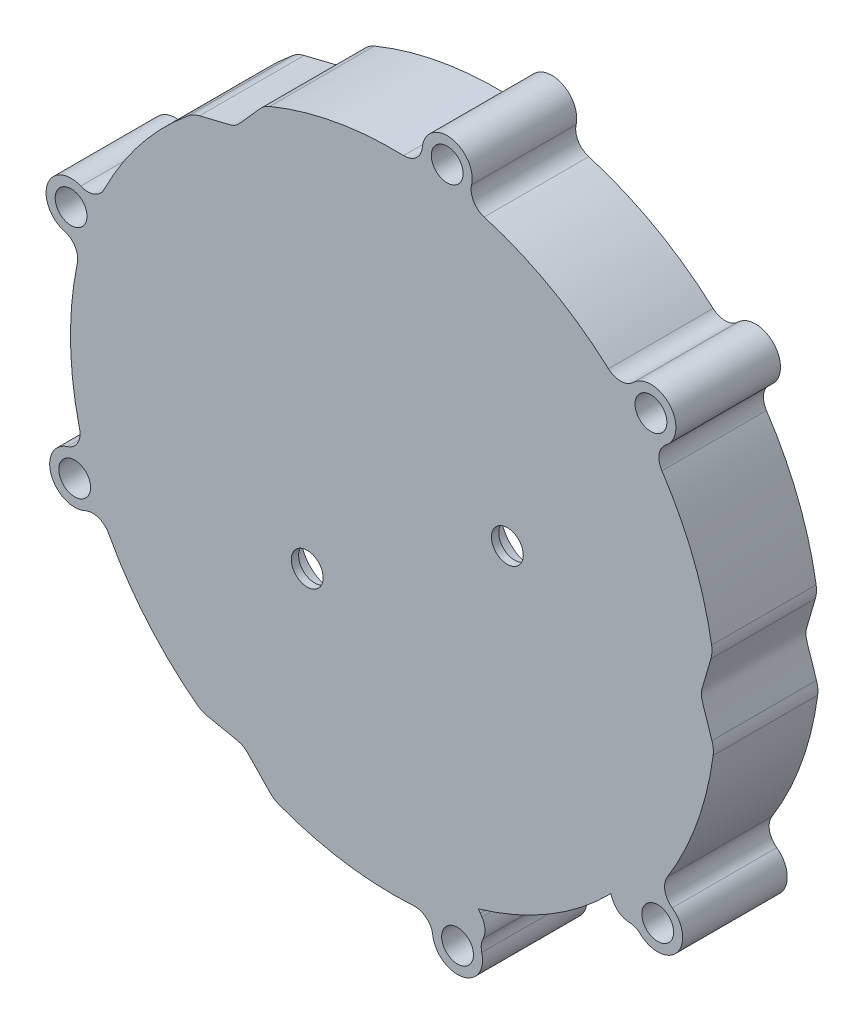
from build123d import *

# Parameters (mm, degrees)
EXTRUDE_2_DEPTH     = 11.5
SKETCH_5_R          = 33.5
EXTRUDE_3_DEPTH     = 3
CUT_EXTRUDE_START   = -11.5
SKETCH_6_R          = 1.75
SKETCH_6_R_2        = 1.55
CUT_EXTRUDE_1_DEPTH = 11.5
SKETCH_7_R          = 1.75
CUT_EXTRUDE_5_DEPTH = 132.924206488
SKETCH_10_R         = 3.75
CUT_EXTRUDE_6_DEPTH = 2.2


with BuildPart() as part:
    # 草图3 → 凸台-拉伸2 (new body)
    with BuildSketch(Plane.XY.offset(-96.014491648)):
        with BuildLine():
            Line((-40.492993239, 24.687278547), (-40.675739889, 24.962512607))
            ThreePointArc((-40.675739889, 24.962512607), (-41.606401052, 25.716071673), (-42.800739744, 25.802885006))
            ThreePointArc((-42.800739744, 25.802885006), (-80.374449004, 45.222565671), (-66.939487097, 85.327545701))
            ThreePointArc((-66.939487097, 85.327545701), (-25.249847673, 78.194412491), (-25.912786435, 35.904128301))
            ThreePointArc((-25.912786435, 35.904128301), (-26.40123425, 34.810784715), (-26.177519013, 33.634377915))
            Line((-26.177519013, 33.634377915), (-26.021463407, 33.343179059))
            ThreePointArc((-26.021463407, 33.343179059), (-25.312936916, 32.588336704), (-24.321913798, 32.288887294))
            ThreePointArc((-24.321913798, 32.288887294), (-23.626933575, 32.140579673), (-23.027680881, 31.758625659))
            ThreePointArc((-23.027680881, 31.758625659), (-21.445252865, 31.04285669), (-19.74949264, 31.418091156))
            ThreePointArc((-19.74949264, 31.418091156), (-18.413329107, 33.667805653), (-19.564814907, 36.017407482))
            ThreePointArc((-19.564814907, 36.017407482), (-20.364881109, 37.252986699), (-20.102685981, 38.701439544))
            ThreePointArc((-20.102685981, 38.701439544), (-16.832689757, 45.474182909), (-15.062839283, 52.783803781))
            ThreePointArc((-15.062839283, 52.783803781), (-15.051236485, 53.469213852), (-15.195529134, 54.139364))
            add(Edge.make_bspline(
                [(-15.319425238, 61.856583739), (-16.49572782, 57.978094374), (-15.195529134, 54.139364)],
                knots=[0, 0, 0, 1, 1, 1], degree=2, weights=[1, 8.246607766, 1]))
            ThreePointArc((-15.319425238, 61.856583739), (-15.196719258, 62.531020416), (-15.230318238, 63.215704794))
            ThreePointArc((-15.230318238, 63.215704794), (-17.226007888, 70.444721896), (-20.695764851, 77.093199319))
            ThreePointArc((-20.695764851, 77.093199319), (-20.808333579, 77.284774589), (-20.898956438, 77.487654603))
            ThreePointArc((-20.898956438, 77.487654603), (-20.953551538, 78.749586356), (-20.241057012, 79.792564747))
            ThreePointArc((-20.241057012, 79.792564747), (-19.26137688, 81.226660066), (-19.336445111, 82.961816342))
            ThreePointArc((-19.336445111, 82.961816342), (-21.319959034, 84.668339374), (-23.833818547, 83.942351293))
            ThreePointArc((-23.833818547, 83.942351293), (-25.189556573, 83.368995985), (-26.570474451, 83.878728977))
            ThreePointArc((-26.570474451, 83.878728977), (-32.983673797, 88.450483927), (-40.247058178, 91.495695992))
            ThreePointArc((-40.247058178, 91.495695992), (-40.456433036, 91.570093379), (-40.656262932, 91.667257235))
            ThreePointArc((-40.656262932, 91.667257235), (-41.509238891, 92.59885907), (-41.633850859, 93.855808482))
            ThreePointArc((-41.633850859, 93.855808482), (-41.805190186, 95.584116524), (-42.978033152, 96.865071337))
            ThreePointArc((-42.978033152, 96.865071337), (-45.594424834, 96.897365647), (-47.053496799, 94.725348761))
            ThreePointArc((-47.053496799, 94.725348761), (-47.723506694, 93.414681511), (-49.10900121, 92.917522737))
            ThreePointArc((-49.10900121, 92.917522737), (-56.60936713, 92.363050854), (-63.824609735, 90.24097589))
            ThreePointArc((-63.824609735, 90.24097589), (-64.423993666, 89.908319173), (-64.932214395, 89.448282999))
            add(Edge.make_bspline(
                [(-71.553574683, 85.482375956), (-67.606553074, 86.40291272), (-64.932214395, 89.448282999)],
                knots=[0, 0, 0, 1, 1, 1], degree=2, weights=[1, 8.246607766, 1]))
            ThreePointArc((-71.553574683, 85.482375956), (-72.199006969, 85.251424113), (-72.775161544, 84.879984354))
            ThreePointArc((-72.775161544, 84.879984354), (-78.037829174, 79.537157868), (-82.060701037, 73.208021481))
            ThreePointArc((-82.060701037, 73.208021481), (-82.170325724, 73.014746469), (-82.30071354, 72.834824764))
            ThreePointArc((-82.30071354, 72.834824764), (-83.366280763, 72.156578189), (-84.625773644, 72.252127162))
            ThreePointArc((-84.625773644, 72.252127162), (-86.357576852, 72.383507575), (-87.822732334, 71.450918397))
            ThreePointArc((-87.822732334, 71.450918397), (-88.308867667, 68.879883427), (-86.423213777, 67.065811271))
            ThreePointArc((-86.423213777, 67.065811271), (-85.248804513, 66.178385351), (-84.999787298, 64.727608899))
            ThreePointArc((-84.999787298, 64.727608899), (-85.752443552, 56.887737871), (-84.757982369, 49.074856447))
            ThreePointArc((-84.757982369, 49.074856447), (-84.717724968, 48.856333808), (-84.701956387, 48.634694114))
            ThreePointArc((-84.701956387, 48.634694114), (-85.082259885, 47.430193489), (-86.108505425, 46.693801882))
            ThreePointArc((-86.108505425, 46.693801882), (-87.51959303, 45.681263421), (-88.042510334, 44.02507507))
            ThreePointArc((-88.042510334, 44.02507507), (-86.762282187, 41.743066253), (-84.151724405, 41.565481306))
            ThreePointArc((-84.151724405, 41.565481306), (-82.681648322, 41.640569343), (-81.558348935, 40.689275282))
            ThreePointArc((-81.558348935, 40.689275282), (-77.327979239, 34.471003799), (-71.882587109, 29.283457891))
            ThreePointArc((-71.882587109, 29.283457891), (-71.294805975, 28.930704538), (-70.642292598, 28.720590563))
            add(Edge.make_bspline(
                [(-63.897036205, 24.969277868), (-66.667755232, 27.927230468), (-70.642292598, 28.720590563)],
                knots=[0, 0, 0, 1, 1, 1], degree=2, weights=[1, 8.246607766, 1]))
            ThreePointArc((-63.897036205, 24.969277868), (-63.374309899, 24.525793034), (-62.764556344, 24.212548414))
            ThreePointArc((-62.764556344, 24.212548414), (-55.506199065, 22.326357798), (-48.013570238, 22.007016761))
            ThreePointArc((-48.013570238, 22.007016761), (-47.791376824, 22.008716505), (-47.570366149, 21.985758196))
            ThreePointArc((-47.570366149, 21.985758196), (-46.450202396, 21.402071776), (-45.90320467, 20.263541953))
            ThreePointArc((-45.90320467, 20.263541953), (-45.151080965, 18.69806868), (-43.610858681, 17.895502823))
            ThreePointArc((-43.610858681, 17.895502823), (-41.14120942, 18.760014757), (-40.513003788, 21.300075001))
            ThreePointArc((-40.513003788, 21.300075001), (-40.566074024, 22.008719301), (-40.368008135, 22.691187687))
            ThreePointArc((-40.368008135, 22.691187687), (-40.16307522, 23.705977946), (-40.492993239, 24.687278547))
        make_face()
        with BuildLine():
            ThreePointArc((-43.420759613, 19.080349794), (-41.644787646, 20.365232502), (-42.929670354, 22.141204469))
            ThreePointArc((-42.929670354, 22.141204469), (-44.705642321, 20.856321761), (-43.420759613, 19.080349794))
        make_face(mode=Mode.SUBTRACT)
        with BuildLine():
            ThreePointArc((-20.365473258, 32.44792992), (-19.830906485, 34.573779953), (-21.956756519, 35.108346725))
            ThreePointArc((-21.956756519, 35.108346725), (-22.491323291, 32.982496692), (-20.365473258, 32.44792992))
        make_face(mode=Mode.SUBTRACT)
    extrude(amount=EXTRUDE_2_DEPTH)

    # 草图5 → 凸台-拉伸3 (add)
    with BuildSketch(Plane.XY.offset(-84.514491648)):
        with Locations((-50.256678709, 57.436079188)):
            Circle(SKETCH_5_R)
    extrude(amount=-EXTRUDE_3_DEPTH)

    # 草图6 → 切除-拉伸1 (cut)
    # profile 1 of 6: a face of its own
    with BuildSketch(Plane.XY.offset(-84.514491648).offset(CUT_EXTRUDE_START)):
        with Locations((-85.689057654, 69.716002733)):
            Circle(SKETCH_6_R)
    # profile 2 of 6: a face of its own
    with BuildSketch(Plane.XY.offset(-84.514491648).offset(CUT_EXTRUDE_START)):
        with Locations((-21.905763489, 81.981457698)):
            Circle(SKETCH_6_R)
    # profile 3 of 6: a face of its own
    with BuildSketch(Plane.XY.offset(-84.514491648).offset(CUT_EXTRUDE_START)):
        with Locations((-44.316082829, 94.462547026)):
            Circle(SKETCH_6_R)
    # profile 4 of 6: a face of its own
    with BuildSketch(Plane.XY.offset(-84.514491648).offset(CUT_EXTRUDE_START)):
        with Locations((-85.292838409, 44.067552214)):
            Circle(SKETCH_6_R)
    # profile 5 of 6: a face of its own
    with BuildSketch(Plane.XY.offset(-84.514491648).offset(CUT_EXTRUDE_START)):
        with Locations((-43.175214984, 20.610777132)):
            Circle(SKETCH_6_R)
        with Locations((-43.175214984, 20.610777132)):
            Circle(SKETCH_6_R_2, mode=Mode.SUBTRACT)
    # profile 6 of 6: a face of its own
    with BuildSketch(Plane.XY.offset(-84.514491648).offset(CUT_EXTRUDE_START)):
        with Locations((-21.161114888, 33.778138322)):
            Circle(SKETCH_6_R)
        with Locations((-21.161114888, 33.778138322)):
            Circle(SKETCH_6_R_2, mode=Mode.SUBTRACT)
    extrude(amount=CUT_EXTRUDE_1_DEPTH, mode=Mode.SUBTRACT)

    # 草图7 → 切除-拉伸5 (cut, through all)
    with BuildSketch(Plane.XY.offset(-84.514491648)):
        with Locations((-37.69843004, 61.425537708)):
            Circle(SKETCH_7_R)
        with Locations((-59.712185407, 48.257600194)):
            Circle(SKETCH_7_R)
    extrude(amount=-CUT_EXTRUDE_5_DEPTH, mode=Mode.SUBTRACT)

    # 草图10 → 切除-拉伸6 (cut)
    with BuildSketch(Plane(origin=(0, 0, -87.514491648), x_dir=(-1, 0, 0), z_dir=(0, 0, -1))):
        with Locations(Location((37.69843004, 61.425537708, 0), (0, 0, 90))):
            Circle(SKETCH_10_R)
        with Locations(Location((59.712185407, 48.257600194, 0), (0, 0, 90))):
            Circle(SKETCH_10_R)
    extrude(amount=-CUT_EXTRUDE_6_DEPTH, mode=Mode.SUBTRACT)


solid = part.part
